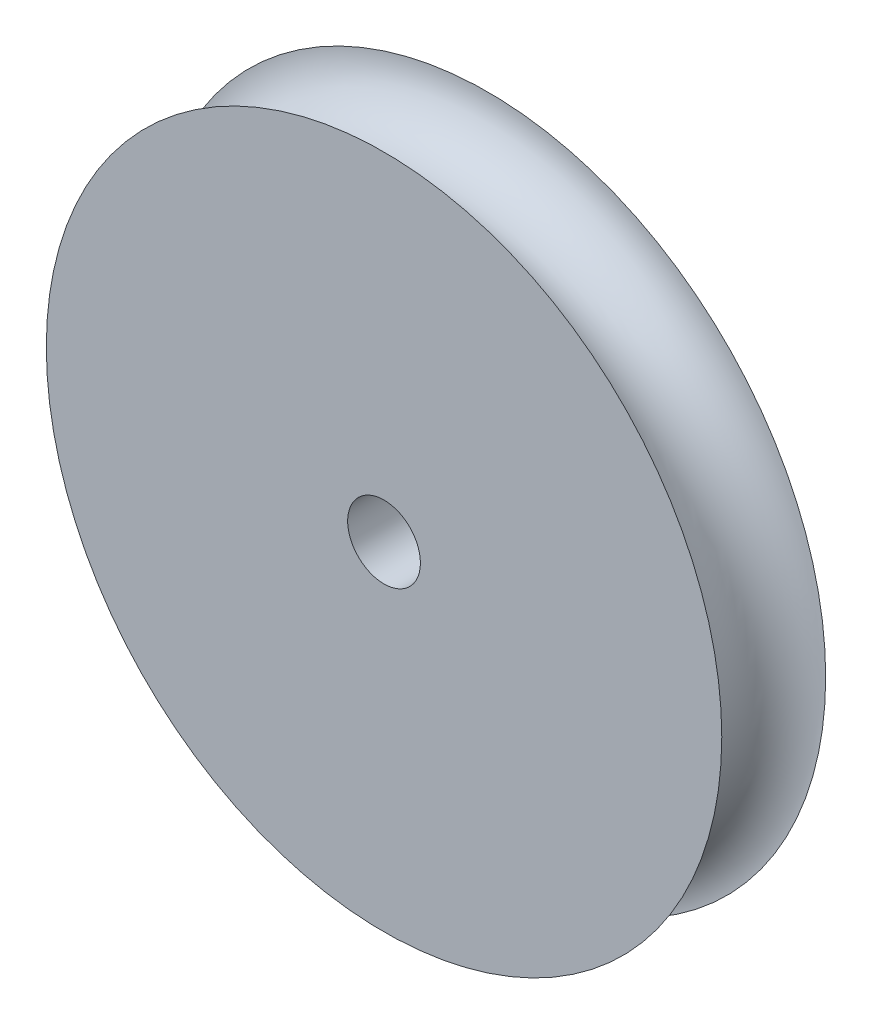
from build123d import *

# Parameters (mm, degrees)
SKETCH3_R          = 3.5
CUT_EXTRUDE1_DEPTH = 425.198074764


with BuildPart() as part:
    # Sketch2 → Revolve1 (revolve)
    with BuildSketch(Plane(origin=(-159.069667209, 156.2967757, 0), x_dir=(0, 0, 1), z_dir=(-0.7132965175568755, 0.7008623816707771, 0)), mode=Mode.PRIVATE) as revolve1_sk:
        with BuildLine():
            Line((29.02737519, 315), (19.02737519, 315))
            Line((19.02737519, 315), (19.02737519, 347.5))
            ThreePointArc((19.02737519, 347.5), (24.02737519, 342.5), (29.02737519, 347.5))
            Line((29.02737519, 347.5), (29.02737519, 315))
        make_face()
    revolve(revolve1_sk.sketch.rotate(Axis((61.701983017, 380.98517873, 29.02737519), (0, 0, -1)), 45.503765984), axis=Axis((61.701983017, 380.98517873, 29.02737519), (0, 0, -1)))

    # Sketch3 → Cut-Extrude1 (cut, through all)
    with BuildSketch(Plane.XY.offset(29.02737519)):
        with Locations((61.701983017, 380.98517873)):
            Circle(SKETCH3_R)
    extrude(amount=-CUT_EXTRUDE1_DEPTH, mode=Mode.SUBTRACT)


solid = part.part
